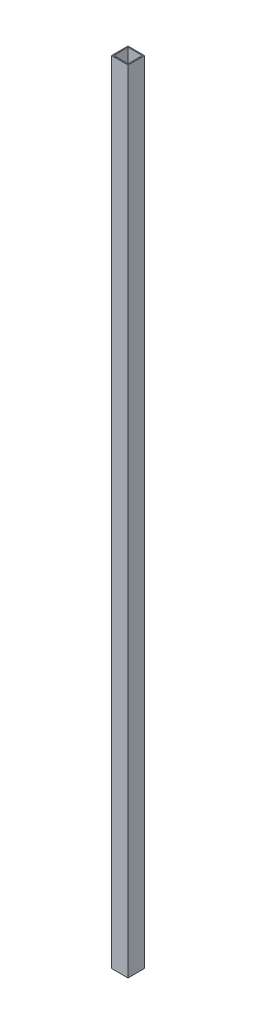
from build123d import *

# Parameters (mm, degrees)
SKETCH1_W           = 50.8
SKETCH1_H           = 50.8
SKETCH1_W_2         = 44.45
SKETCH1_H_2         = 44.45
BOSS_EXTRUDE1_DEPTH = 2438.4


with BuildPart() as part:
    # Sketch1 → Boss-Extrude1 (new body)
    with BuildSketch(Plane(origin=(0, 0, 0), x_dir=(1, 0, 0), z_dir=(0, 1, 0))):
        Rectangle(SKETCH1_W, SKETCH1_H)
        Rectangle(SKETCH1_W_2, SKETCH1_H_2, mode=Mode.SUBTRACT)
    extrude(amount=BOSS_EXTRUDE1_DEPTH)


solid = part.part
